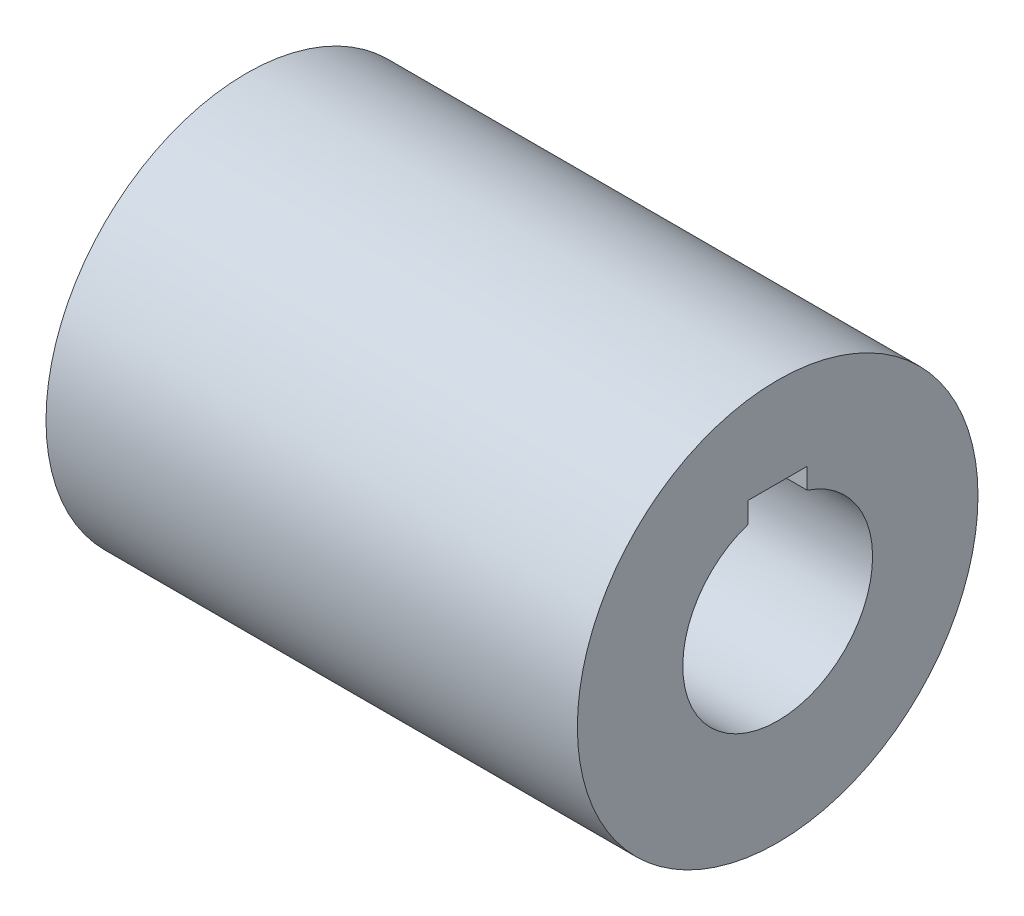
from build123d import *

# Parameters (mm, degrees)
SKETCH_1_R          = 47.5
EXTRUDE_1_DEPTH     = 63
CUT_EXTRUDE_1_DEPTH = 102.432243394
CUT_EXTRUDE_2_DEPTH = 102.432243394


with BuildPart() as part:
    # Эскиз1 → Бобышка-Вытянуть1 (new, symmetric)
    with BuildSketch(Plane(origin=(0, 0, 0), x_dir=(0, 0, -1), z_dir=(1, 0, 0))):
        Circle(SKETCH_1_R)
    extrude(amount=EXTRUDE_1_DEPTH, both=True)

    # Эскиз2 → Вырез-Вытянуть1 (cut, through all)
    with BuildSketch(Plane(origin=(-13, 0, 0), x_dir=(0, 0, -1), z_dir=(1, 0, 0))):
        with BuildLine():
            Line((-8, 31.8), (8, 31.8))
            Line((8, 31.8), (8, 26.310644234))
            ThreePointArc((8, 26.310644234), (0, -27.5), (-8, 26.310644234))
            Line((-8, 26.310644234), (-8, 31.8))
        make_face()
    extrude(amount=-CUT_EXTRUDE_1_DEPTH, mode=Mode.SUBTRACT)

    # Эскиз3 → Вырез-Вытянуть2 (cut, through all)
    with BuildSketch(Plane(origin=(13, 0, 0), x_dir=(0, 0, -1), z_dir=(1, 0, 0))):
        with BuildLine():
            Line((-7, 26.30340478), (7, 26.30340478))
            Line((7, 26.30340478), (7, 21.38340478))
            ThreePointArc((7, 21.38340478), (0, -22.5), (-7, 21.38340478))
            Line((-7, 21.38340478), (-7, 26.30340478))
        make_face()
    extrude(amount=CUT_EXTRUDE_2_DEPTH, mode=Mode.SUBTRACT)


solid = part.part
